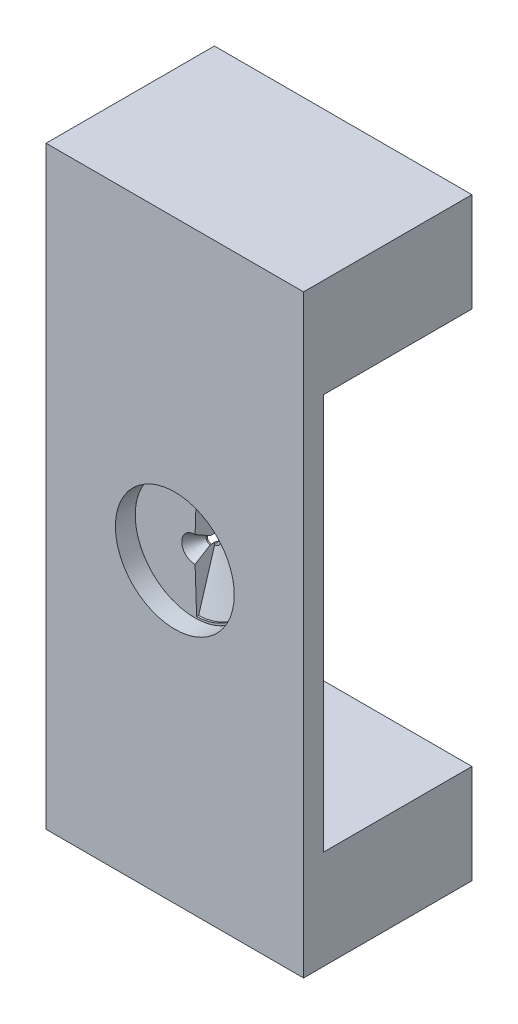
from build123d import *

# Parameters (mm, degrees)
SKETCH_1_W                    = 60
SKETCH_1_H                    = 26
SKETCH_1_R                    = 6
EXTRUDE_1_DEPTH               = 2
SKETCH_3_R                    = 6
EXTRUDE_3_DEPTH               = 2.2
SKETCH_5_W                    = 4.6
SKETCH_5_H                    = 2
CUT_EXTRUDE_1_DEPTH           = 6
SKETCH_7_R                    = 0.2
CUT_EXTRUDE_2_DEPTH           = 12
CUT_REVOLVE_4_ANGLE           = 90
CUT_REVOLVE_4_OTHER_WAY_ANGLE = 90
CUT_REVOLVE_5_ANGLE           = 90
CUT_REVOLVE_5_OTHER_WAY_ANGLE = 90
CUT_REVOLVE_6_ANGLE           = 88
CUT_REVOLVE_6_OTHER_WAY_ANGLE = 88
SKETCH_16_R                   = 0.4
CUT_EXTRUDE_4_DEPTH           = 0.7
SKETCH_20_W                   = 17
SKETCH_20_H                   = 26
CUT_EXTRUDE_5_DEPTH           = 10
SKETCH_21_W                   = 26
SKETCH_21_H                   = 2
EXTRUDE_4_DEPTH               = 17
SKETCH_22_W                   = 26
SKETCH_22_H                   = 2
EXTRUDE_6_DEPTH               = 17
SKETCH_23_W                   = 26
SKETCH_23_H                   = 10
EXTRUDE_7_DEPTH               = 15


with BuildPart() as part:
    # 草图1 → 凸台-拉伸1 (new body)
    with BuildSketch(Plane.XY):
        Rectangle(SKETCH_1_W, SKETCH_1_H)
        Circle(SKETCH_1_R, mode=Mode.SUBTRACT)
    extrude(amount=EXTRUDE_1_DEPTH)

    # 草图20 → 切除-拉伸5 (cut)
    with BuildSketch(Plane.XY.offset(2)):
        with Locations((-21.5, 0)):
            Rectangle(SKETCH_20_W, SKETCH_20_H)
        with Locations((21.5, 0)):
            Rectangle(SKETCH_20_W, SKETCH_20_H)
    extrude(amount=-CUT_EXTRUDE_5_DEPTH, mode=Mode.SUBTRACT)

    # 草图21 → 凸台-拉伸4 (add)
    with BuildSketch(Plane(origin=(0, 13, 0), x_dir=(1, 0, 0), z_dir=(0, 1, 0))):
        with Locations((0, -1)):
            Rectangle(SKETCH_21_W, SKETCH_21_H)
    extrude(amount=EXTRUDE_4_DEPTH)

    # 草图22 → 凸台-拉伸6 (add)
    with BuildSketch(Plane.XZ.offset(13)):
        with Locations((0, 1)):
            Rectangle(SKETCH_22_W, SKETCH_22_H)
    extrude(amount=EXTRUDE_6_DEPTH)

    # 草图23 → 凸台-拉伸7 (add)
    with BuildSketch(Plane(origin=(0, 0, 0), x_dir=(-1, 0, 0), z_dir=(0, 0, -1))):
        with Locations((0, 25)):
            Rectangle(SKETCH_23_W, SKETCH_23_H)
        with Locations((0, -25)):
            Rectangle(SKETCH_23_W, SKETCH_23_H)
    extrude(amount=EXTRUDE_7_DEPTH)


with BuildPart() as body_2:
    # 草图3 → 凸台-拉伸3 (new body)
    with BuildSketch(Plane(origin=(0, 0, 0), x_dir=(-1, 0, 0), z_dir=(0, 0, -1))):
        Circle(SKETCH_3_R)
    extrude(amount=EXTRUDE_3_DEPTH)

    # 草图5 → 切除-拉伸1 (cut, symmetric)
    with BuildSketch(Plane(origin=(0, 0, 0), x_dir=(1, 0, 0), z_dir=(0, 1, 0))):
        with Locations((-3.7, 1.2)):
            Rectangle(SKETCH_5_W, SKETCH_5_H)
    extrude(amount=CUT_EXTRUDE_1_DEPTH, both=True, mode=Mode.SUBTRACT)

    # 草图7 → 切除-拉伸2 (cut)
    with BuildSketch(Plane(origin=(0, 0, -2.2), x_dir=(-1, 0, 0), z_dir=(0, 0, -1))):
        Circle(SKETCH_7_R)
    extrude(amount=-CUT_EXTRUDE_2_DEPTH, mode=Mode.SUBTRACT)

    # 草图6 → 切除-旋转4 (revolve, cut)
    with BuildSketch(Plane(origin=(0, 0, 0), x_dir=(1, 0, 0), z_dir=(0, 1, 0))):
        Polygon((0.5, 2.2), (6, 2.2), (6, 0.2), align=None)
    revolve(axis=Axis((0, 0, 0), (0, 0, -1)), revolution_arc=CUT_REVOLVE_4_ANGLE, mode=Mode.SUBTRACT)

    # 草图6 → 切除-旋转4 other way (revolve, cut)
    with BuildSketch(Plane(origin=(0, 0, 0), x_dir=(1, 0, 0), z_dir=(0, 1, 0))):
        Polygon((0.5, 2.2), (6, 2.2), (6, 0.2), align=None)
    revolve(axis=Axis((0, 0, 0), (0, 0, 1)), revolution_arc=CUT_REVOLVE_4_OTHER_WAY_ANGLE, mode=Mode.SUBTRACT)

    # 草图9 → 切除-旋转5 (revolve, cut)
    with BuildSketch(Plane(origin=(0, 0, 0), x_dir=(1, 0, 0), z_dir=(0, 1, 0))):
        Polygon((-1.4, 2.2), (-6, 2.2), (-6, 0.2), (-1.4, 0.2), (-0.468510194, 1.7), (0, 1.7), (0, 2.2), align=None)
    revolve(axis=Axis((0, 0, -1.7), (0, 0, 1)), revolution_arc=CUT_REVOLVE_5_ANGLE, mode=Mode.SUBTRACT)

    # 草图9 → 切除-旋转5 other way (revolve, cut)
    with BuildSketch(Plane(origin=(0, 0, 0), x_dir=(1, 0, 0), z_dir=(0, 1, 0))):
        Polygon((-1.4, 2.2), (-6, 2.2), (-6, 0.2), (-1.4, 0.2), (-0.468510194, 1.7), (0, 1.7), (0, 2.2), align=None)
    revolve(axis=Axis((0, 0, -1.7), (0, 0, -1)), revolution_arc=CUT_REVOLVE_5_OTHER_WAY_ANGLE, mode=Mode.SUBTRACT)

    # 草图12 → 切除-旋转6 (revolve, cut)
    with BuildSketch(Plane(origin=(0, 0, 0), x_dir=(1, 0, 0), z_dir=(0, 1, 0))):
        Polygon((5.8, 0.2), (0.622155655, 2), (0.2, 2), (0.2, 0.2), (0.2, -0.434939874), (5.8, -0.434939874), align=None)
    revolve(axis=Axis((0, 0, -2.2), (0, 0, -1)), revolution_arc=CUT_REVOLVE_6_ANGLE, mode=Mode.SUBTRACT)

    # 草图12 → 切除-旋转6 other way (revolve, cut)
    with BuildSketch(Plane(origin=(0, 0, 0), x_dir=(1, 0, 0), z_dir=(0, 1, 0))):
        Polygon((5.8, 0.2), (0.622155655, 2), (0.2, 2), (0.2, 0.2), (0.2, -0.434939874), (5.8, -0.434939874), align=None)
    revolve(axis=Axis((0, 0, -2.2), (0, 0, 1)), revolution_arc=CUT_REVOLVE_6_OTHER_WAY_ANGLE, mode=Mode.SUBTRACT)

    # 草图16 → 切除-拉伸4 (cut)
    with BuildSketch(Plane(origin=(0, 0, -2.2), x_dir=(-1, 0, 0), z_dir=(0, 0, -1))):
        with Locations(Location((0, 0, 0), (0, 0, 270))):
            Circle(SKETCH_16_R)
    extrude(amount=-CUT_EXTRUDE_4_DEPTH, mode=Mode.SUBTRACT)

    # 草图19 → 切除-旋转8 (revolve, cut)
    with BuildSketch(Plane(origin=(0, 0, 0), x_dir=(1, 0, 0), z_dir=(0, 1, 0)), mode=Mode.PRIVATE) as cut_revolve_8_sk:
        Polygon((-0.4, 1.568775044), (0, 1.568775044), (0, 0), (-1.3, 0), align=None)
    revolve(cut_revolve_8_sk.sketch.rotate(Axis((0, 0, 0), (0, 0, 1)), 270), axis=Axis((0, 0, 0), (0, 0, 1)), mode=Mode.SUBTRACT)


solid = Compound([part.part, body_2.part])
